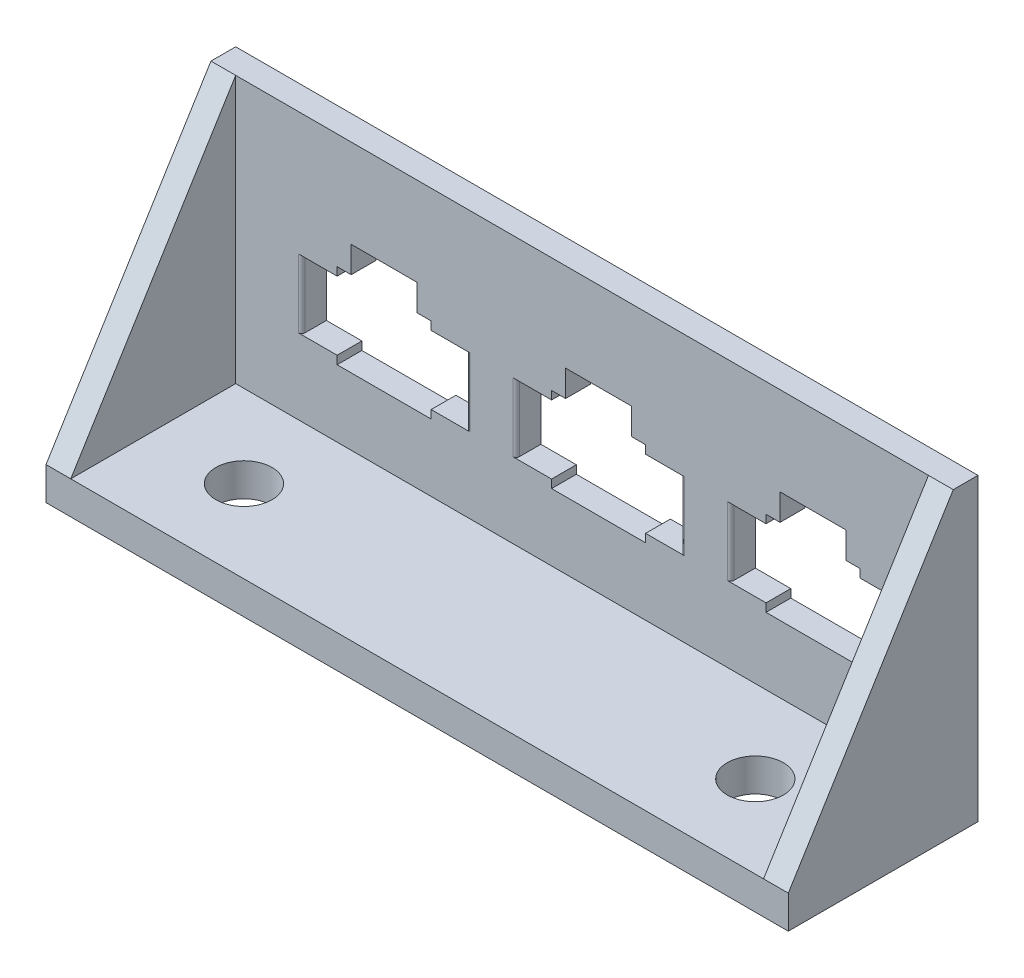
from build123d import *

# Parameters (mm, degrees)
SKETCH1_W            = 42
SKETCH1_H            = 18.183578202
BOSS_EXTRUDE1_DEPTH  = 1.5
SKETCH2_W            = 42
SKETCH2_H            = 2
BOSS_EXTRUDE2_DEPTH  = 10
BOSS_EXTRUDE4_DEPTH  = 1.5
BOSS_EXTRUDE5_START  = -42
BOSS_EXTRUDE5_DEPTH  = 1.5
M3_CLEARANCE_HOLE2_D = 3.4
FILLET4_R            = 0.2


with BuildPart() as part:
    # Sketch1 → Boss-Extrude1 (new body)
    with BuildSketch(Plane.XY):
        with Locations((-17.985553167, 50.952165471)):
            Rectangle(SKETCH1_W, SKETCH1_H)
        Polygon((-27.135553167, 52.575255776), (-27.135553167, 53.075255776), (-27.985553167, 53.075255776), (-27.985553167, 54.675255776), (-31.985553167, 54.675255776), (-31.985553167, 53.075255776), (-32.835553167, 53.075255776), (-32.835553167, 52.575255776), (-34.985553167, 52.575255776), (-34.985553167, 48.425255776), (-32.835553167, 48.425255776), (-32.835553167, 47.925255776), (-27.135553167, 47.925255776), (-27.135553167, 48.425255776), (-24.985553167, 48.425255776), (-24.985553167, 52.575255776), align=None, mode=Mode.SUBTRACT)
        Polygon((-14.135553167, 52.575255776), (-14.135553167, 53.075255776), (-14.985553167, 53.075255776), (-14.985553167, 54.675255776), (-18.985553167, 54.675255776), (-18.985553167, 53.075255776), (-19.835553167, 53.075255776), (-19.835553167, 52.575255776), (-21.985553167, 52.575255776), (-21.985553167, 48.425255776), (-19.835553167, 48.425255776), (-19.835553167, 47.925255776), (-14.135553167, 47.925255776), (-14.135553167, 48.425255776), (-11.985553167, 48.425255776), (-11.985553167, 52.575255776), align=None, mode=Mode.SUBTRACT)
        Polygon((-1.135553167, 52.575255776), (-1.135553167, 53.075255776), (-1.985553167, 53.075255776), (-1.985553167, 54.675255776), (-5.985553167, 54.675255776), (-5.985553167, 53.075255776), (-6.835553167, 53.075255776), (-6.835553167, 52.575255776), (-8.985553167, 52.575255776), (-8.985553167, 48.425255776), (-6.835553167, 48.425255776), (-6.835553167, 47.925255776), (-1.135553167, 47.925255776), (-1.135553167, 48.425255776), (1.014446833, 48.425255776), (1.014446833, 52.575255776), align=None, mode=Mode.SUBTRACT)
    extrude(amount=BOSS_EXTRUDE1_DEPTH)

    # Sketch2 → Boss-Extrude2 (add)
    with BuildSketch(Plane.XY.offset(1.5)):
        with Locations((-17.985553167, 42.86037637)):
            Rectangle(SKETCH2_W, SKETCH2_H)
    extrude(amount=BOSS_EXTRUDE2_DEPTH)

    # Sketch7 → Boss-Extrude4 (add)
    with BuildSketch(Plane.ZY.offset(38.985553167)):
        Polygon((11.5, 43.86037637), (1.5, 60.043954572), (0, 60.043954572), (0, 41.86037637), (11.5, 41.86037637), align=None)
    extrude(amount=BOSS_EXTRUDE4_DEPTH)

    # Sketch7<3> → Boss-Extrude5 (add)
    with BuildSketch(Plane.ZY.offset(38.985553167).offset(BOSS_EXTRUDE5_START)):
        Polygon((11.5, 43.86037637), (1.5, 60.043954572), (0, 60.043954572), (0, 41.86037637), (11.5, 41.86037637), align=None)
    extrude(amount=-BOSS_EXTRUDE5_DEPTH)

    # M3 Clearance Hole2 (through all)
    with Locations(Plane(origin=(0, 43.86037637, 0), x_dir=(1, 0, 0), z_dir=(0, 1, 0))):
        with Locations((-33.485553167, -6.5), (-2.485553167, -6.5)):
            Hole(M3_CLEARANCE_HOLE2_D / 2)

    # Fillet4
    fillet4_edges = [part.edges().sort_by_distance(p)[0] for p in [
        (-34.985553167, 50.500255776, 1.5),
        (-24.985553167, 50.500255776, 1.5),
        (-21.985553167, 50.500255776, 1.5),
        (-11.985553167, 50.500255776, 1.5),
        (-8.985553167, 50.500255776, 1.5),
        (1.014446833, 50.500255776, 1.5),
    ]]
    fillet(fillet4_edges, radius=FILLET4_R)


solid = part.part
